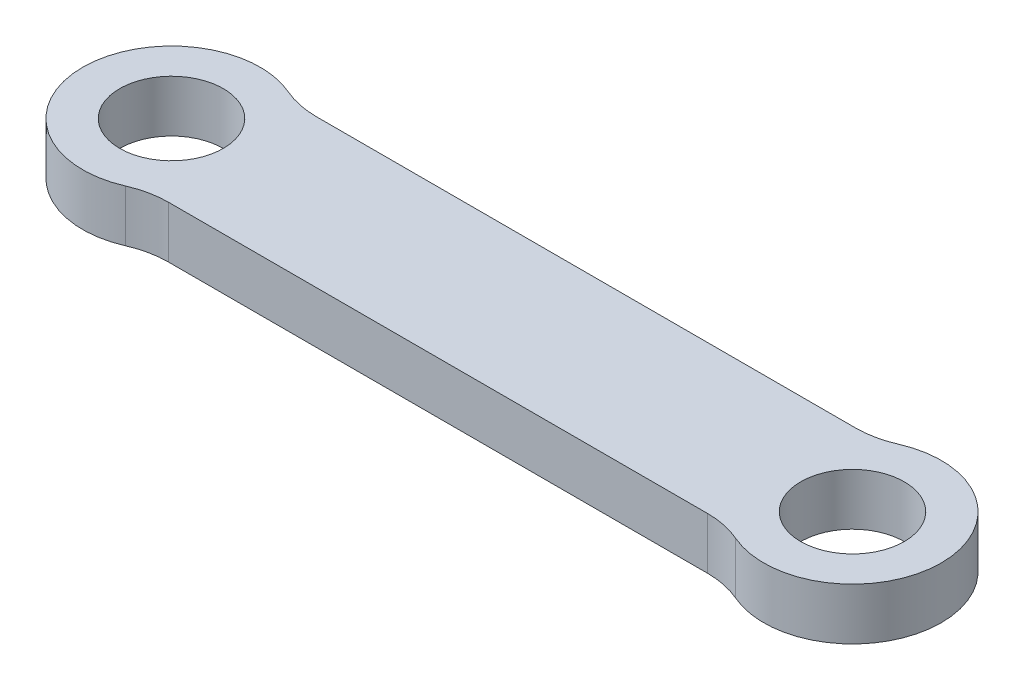
from build123d import *

# Parameters (mm, degrees)
SKETCH1_R           = 1.75
BOSS_EXTRUDE1_DEPTH = 1.75
FILLET1_R           = 3


with BuildPart() as part:
    # Sketch1 → Boss-Extrude1 (new body)
    with BuildSketch(Plane(origin=(0, 0, 0), x_dir=(1, 0, 0), z_dir=(0, 1, 0))):
        with BuildLine():
            ThreePointArc((1.658312395, 2.5), (-3, 0), (1.658312395, -2.5))
            Line((1.658312395, -2.5), (21.341687605, -2.5))
            ThreePointArc((21.341687605, -2.5), (26, 0), (21.341687605, 2.5))
            Line((21.341687605, 2.5), (1.658312395, 2.5))
        make_face()
        with Locations(Location((0, 0, 0), (0, 0, 270))):
            Circle(SKETCH1_R, mode=Mode.SUBTRACT)
        with Locations(Location((23, 0, 0), (0, 0, 270))):
            Circle(SKETCH1_R, mode=Mode.SUBTRACT)
    extrude(amount=BOSS_EXTRUDE1_DEPTH)

    # Fillet1
    fillet1_edges = [part.edges().sort_by_distance(p)[0] for p in [
        (21.341687605, 0.875, 2.5),
        (1.658312395, 0.875, 2.5),
        (1.658312395, 0.875, -2.5),
        (21.341687605, 0.875, -2.5),
    ]]
    fillet(fillet1_edges, radius=FILLET1_R)


solid = part.part
